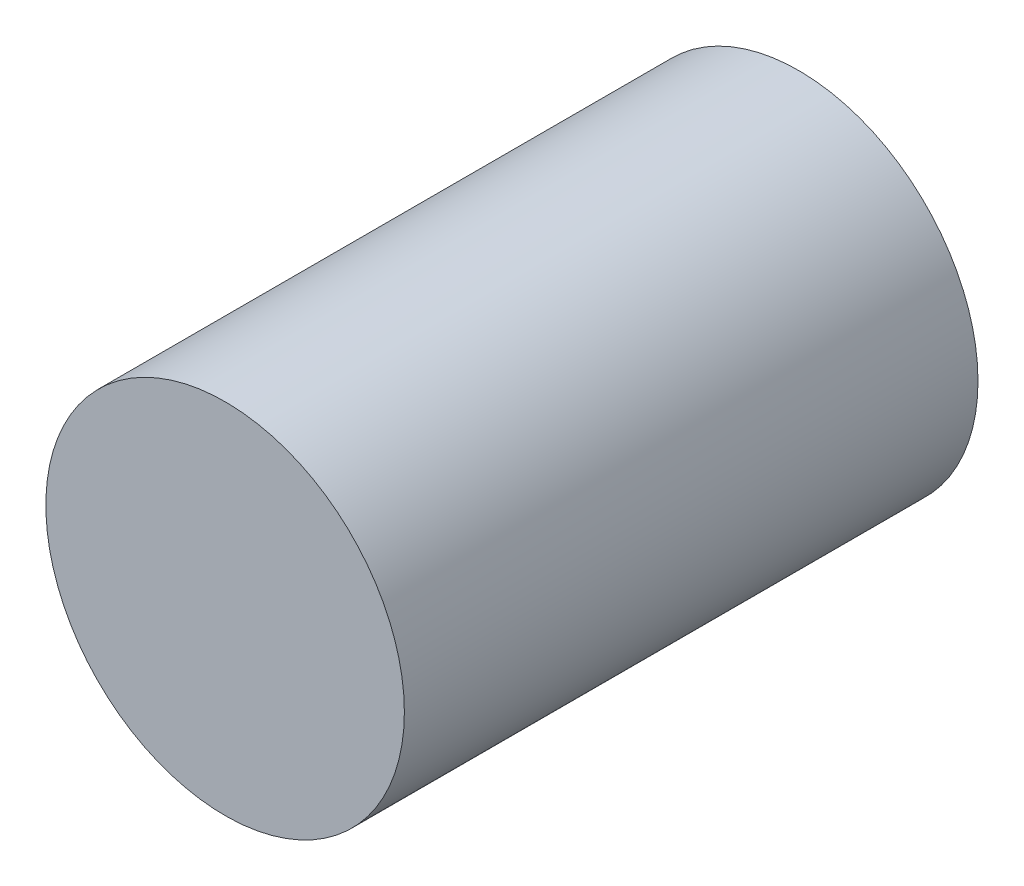
from build123d import *

# Parameters (mm, degrees)
SKETCH1_R           = 5
BOSS_EXTRUDE1_DEPTH = 16


with BuildPart() as part:
    # Sketch1 → Boss-Extrude1 (new body)
    with BuildSketch(Plane.XY):
        Circle(SKETCH1_R)
    extrude(amount=BOSS_EXTRUDE1_DEPTH)


solid = part.part
